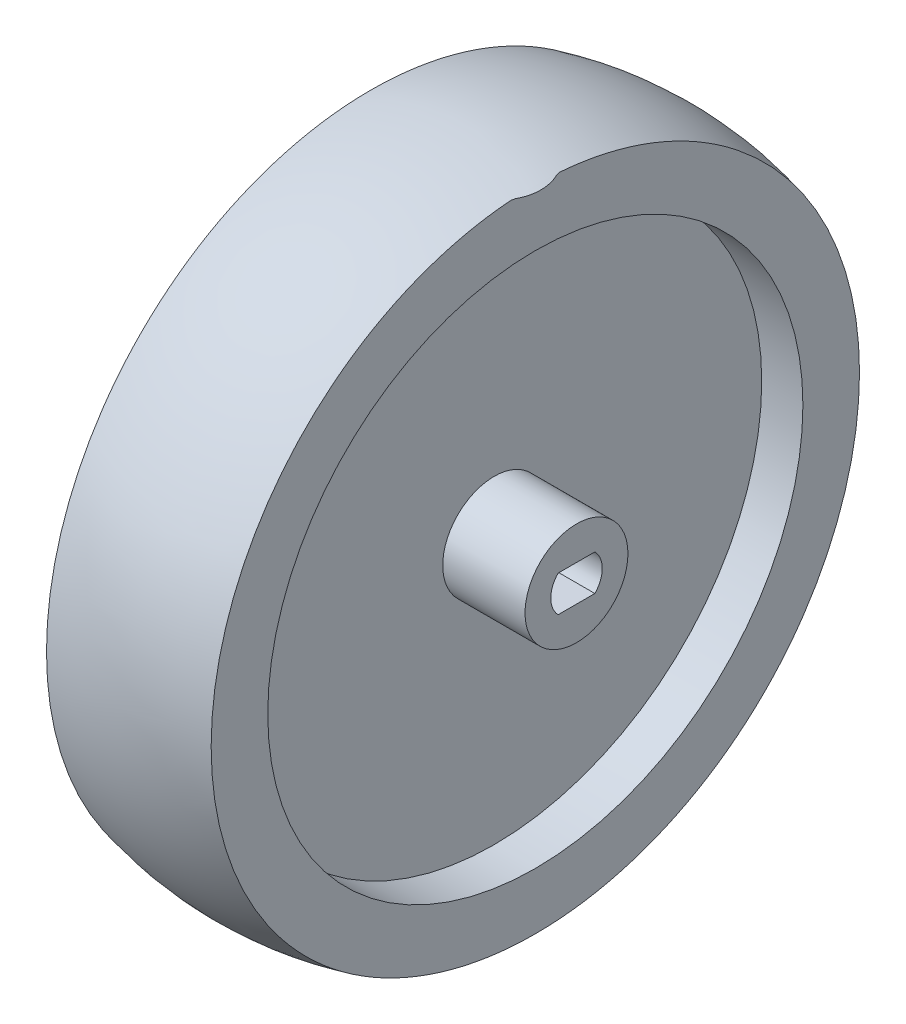
from build123d import *

# Parameters (mm, degrees)
CUT_EXTRUDE_1_DEPTH      = 57.291651246
CUT_EXTRUDE_1_DEPTH_BACK = 57.291651246
SKETCH_2_OUTSIDE_W       = 89.516
SKETCH_2_OUTSIDE_H       = 89.516
SKETCH_2_OUTSIDE_W_2     = 16
SKETCH_2_OUTSIDE_H_2     = 65
SKETCH_3_R               = 26
CUT_EXTRUDE_2_DEPTH      = 4
CUT_EXTRUDE_START        = -4
SKETCH_4_R               = 26
CUT_EXTRUDE_3_DEPTH      = 4
SKETCH_5_R               = 5
EXTRUDE_2_DEPTH          = 8
SKETCH_6_R               = 4.25
CUT_EXTRUDE_6_DEPTH      = 4
SKETCH_7_R               = 1.75
CUT_EXTRUDE_7_DEPTH      = 48.502631506


with BuildPart() as part:
    # 草图1 → 旋转3 (revolve)
    with BuildSketch(Plane.XY):
        with BuildLine():
            Line((3.869127368, 32.268868177), (-3.869127368, -32.268868177))
            ThreePointArc((-3.869127368, -32.268868177), (-32.268868177, 3.869127368), (3.869127368, 32.268868177))
        make_face()
    revolve(axis=Axis((3.869127368, 32.268868177, 0), (-0.11905007287477921, -0.9928882515915424, 0)))

    # 草图2 outside → 切除-拉伸1 (cut, two sides: drawn at the far end of the back side and taken through both)
    with BuildSketch(Plane(origin=(0, 0, 0), x_dir=(1, 0, 0), z_dir=(0, 1, 0)).offset(-CUT_EXTRUDE_1_DEPTH_BACK)):
        Rectangle(SKETCH_2_OUTSIDE_W, SKETCH_2_OUTSIDE_H)
        Rectangle(SKETCH_2_OUTSIDE_W_2, SKETCH_2_OUTSIDE_H_2, mode=Mode.SUBTRACT)
    extrude(amount=CUT_EXTRUDE_1_DEPTH + CUT_EXTRUDE_1_DEPTH_BACK, mode=Mode.SUBTRACT)

    # 草图3 → 切除-拉伸2 (cut)
    with BuildSketch(Plane(origin=(8, 0, 0), x_dir=(0, 0, -1), z_dir=(1, 0, 0))):
        Circle(SKETCH_3_R)
    extrude(amount=-CUT_EXTRUDE_2_DEPTH, mode=Mode.SUBTRACT)

    # 草图4 → 切除-拉伸3 (cut)
    with BuildSketch(Plane.ZY.offset(8).offset(CUT_EXTRUDE_START)):
        with Locations(Location((0, 0, 0), (0, 0, 180))):
            Circle(SKETCH_4_R)
    extrude(amount=CUT_EXTRUDE_3_DEPTH, mode=Mode.SUBTRACT)

    # 草图5 → 凸台-拉伸2 (add)
    with BuildSketch(Plane(origin=(4, 0, 0), x_dir=(0, 0, -1), z_dir=(1, 0, 0))):
        Circle(SKETCH_5_R)
        with BuildLine():
            Line((-1.785357107, 1.75), (1.785357107, 1.75))
            ThreePointArc((1.785357107, 1.75), (2.5, 0), (1.785357107, -1.75))
            Line((1.785357107, -1.75), (-1.785357107, -1.75))
            ThreePointArc((-1.785357107, -1.75), (-2.5, 0), (-1.785357107, 1.75))
        make_face(mode=Mode.SUBTRACT)
    extrude(amount=EXTRUDE_2_DEPTH)

    # 草图6 → 切除-拉伸6 (cut)
    with BuildSketch(Plane.ZY.offset(8).offset(CUT_EXTRUDE_START)):
        Circle(SKETCH_6_R)
    extrude(amount=-CUT_EXTRUDE_6_DEPTH, mode=Mode.SUBTRACT)

    # 草图7 → 切除-拉伸7 (cut, through all)
    with BuildSketch(Plane.ZY):
        Circle(SKETCH_7_R)
    extrude(amount=-CUT_EXTRUDE_7_DEPTH, mode=Mode.SUBTRACT)


solid = part.part
